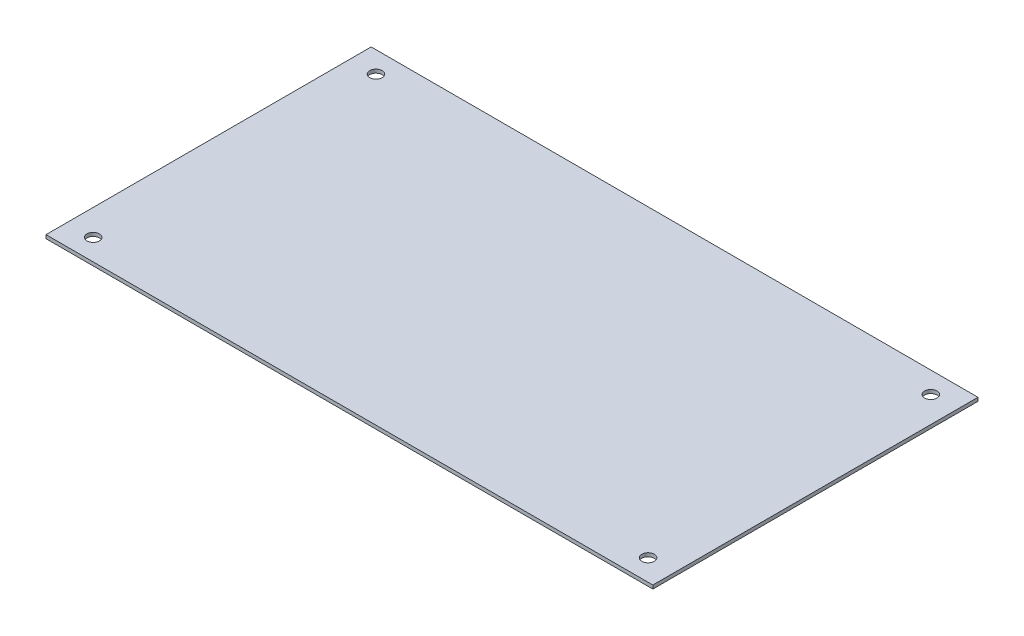
from build123d import *

# Parameters (mm, degrees)
SKETCH1_W           = 171.7
SKETCH1_H           = 92
SKETCH1_R           = 1.75
BOSS_EXTRUDE1_DEPTH = 1


with BuildPart() as part:
    # Sketch1 → Boss-Extrude1 (new body)
    with BuildSketch(Plane(origin=(0, 0, 0), x_dir=(1, 0, 0), z_dir=(0, 1, 0))):
        Rectangle(SKETCH1_W, SKETCH1_H)
        with Locations(Location((-78.5, 40, 0), (0, 0, 270))):
            Circle(SKETCH1_R, mode=Mode.SUBTRACT)
        with Locations(Location((78.5, 40, 0), (0, 0, 270))):
            Circle(SKETCH1_R, mode=Mode.SUBTRACT)
        with Locations(Location((-78.5, -40, 0), (0, 0, 270))):
            Circle(SKETCH1_R, mode=Mode.SUBTRACT)
        with Locations(Location((78.5, -40, 0), (0, 0, 270))):
            Circle(SKETCH1_R, mode=Mode.SUBTRACT)
    extrude(amount=BOSS_EXTRUDE1_DEPTH)


solid = part.part
